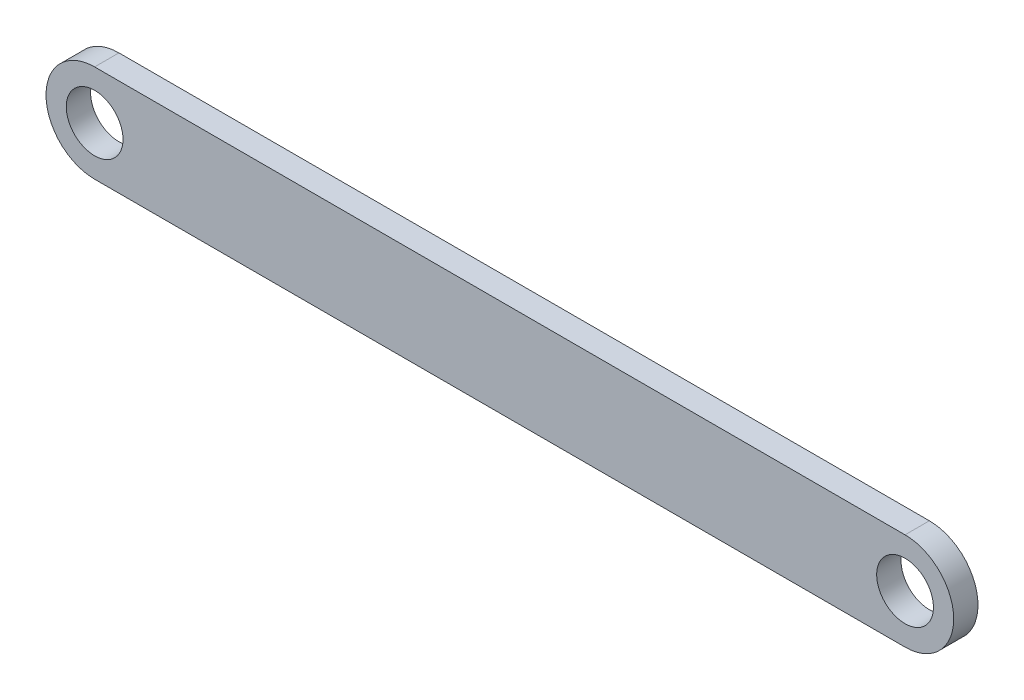
from build123d import *

# Parameters (mm, degrees)
IZIM1_R                     = 3.5
Y_KSEKLIK_EKSTR_ZYON1_DEPTH = 3


with BuildPart() as part:
    # Çizim1 → Yükseklik-Ekstrüzyon1 (new body)
    with BuildSketch(Plane.XY):
        with BuildLine():
            Line((-50, 6), (50, 6))
            ThreePointArc((50, 6), (56, 0), (50, -6))
            Line((50, -6), (-50, -6))
            ThreePointArc((-50, -6), (-56, 0), (-50, 6))
        make_face()
        with Locations((50, 0)):
            Circle(IZIM1_R, mode=Mode.SUBTRACT)
        with Locations((-50, 0)):
            Circle(IZIM1_R, mode=Mode.SUBTRACT)
    extrude(amount=Y_KSEKLIK_EKSTR_ZYON1_DEPTH)


solid = part.part
